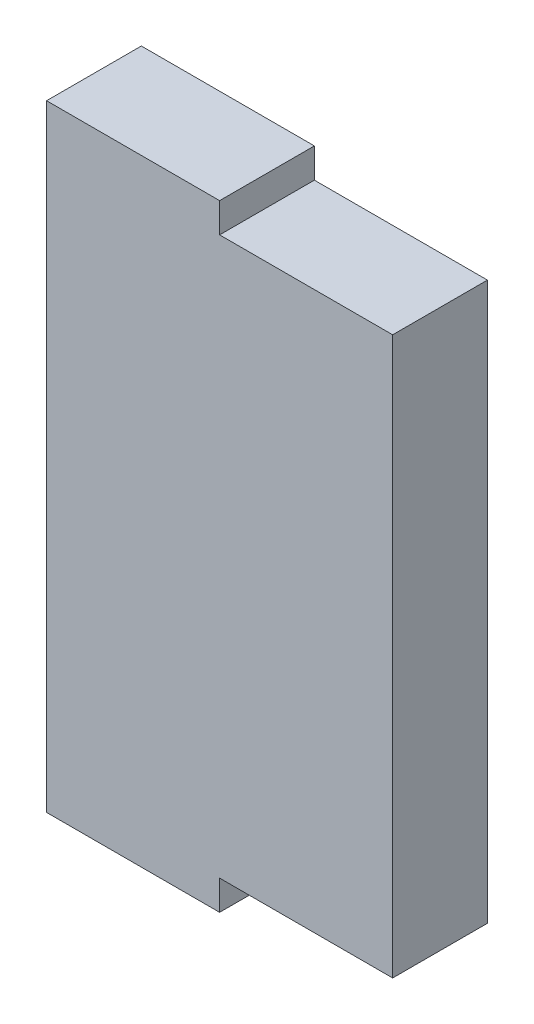
from build123d import *

# Parameters (mm, degrees)
BOSS_EXTRUDE1_DEPTH = 57.5


with BuildPart() as part:
    # Sketch2 → Boss-Extrude1 (new body)
    with BuildSketch(Plane.XY):
        Polygon((-105, 68), (-105, -306), (0, -306), (0, -288), (105, -288), (105, 50), (0, 50), (0, 68), align=None)
    extrude(amount=BOSS_EXTRUDE1_DEPTH)


solid = part.part
